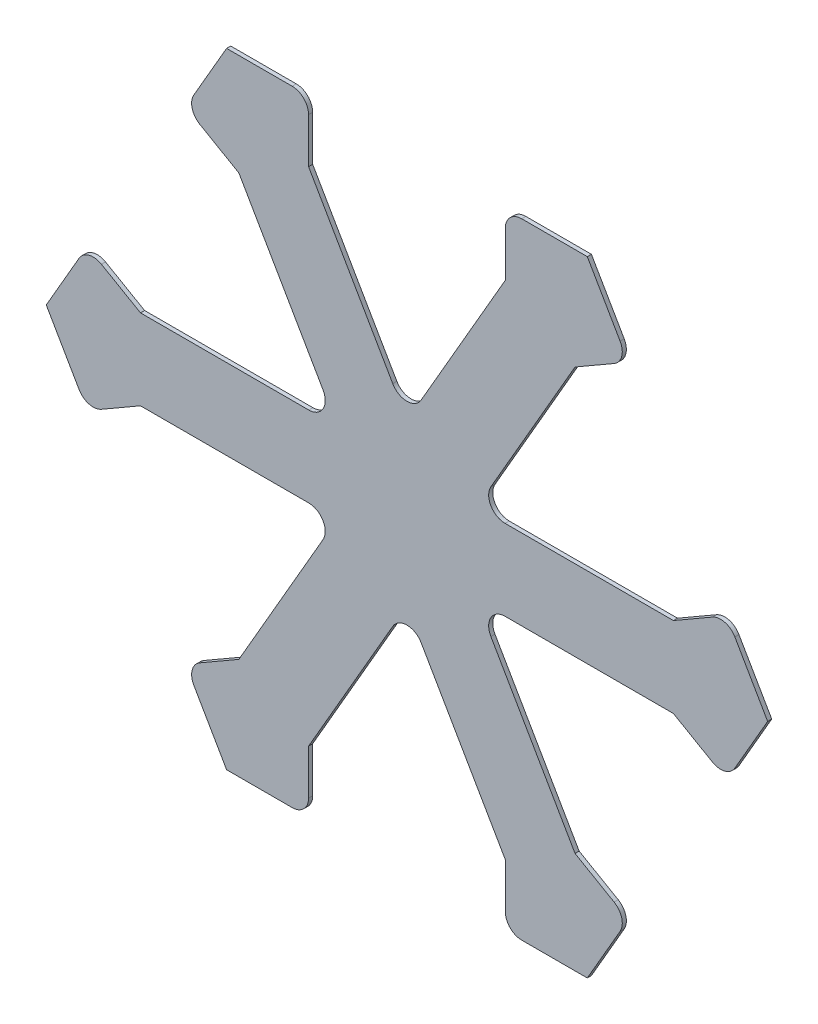
from build123d import *

# Parameters (mm, degrees)
BOSS_EXTRU_2_DEPTH = 5


with BuildPart() as part:
    # Esquisse2 → Boss.-Extru.2 (new body)
    with BuildSketch(Plane.XY):
        with BuildLine():
            Line((-440, 0), (-400, -69.282032303))
            ThreePointArc((-400, -69.282032303), (-387.855872826, -78.600548829), (-372.679491924, -76.602540378))
            Line((-372.679491924, -76.602540378), (-325.048094716, -49.102540378))
            Line((-325.048094716, -49.102540378), (-119.689110868, -49.102540378))
            ThreePointArc((-119.689110868, -49.102540378), (-102.368602792, -59.102540378), (-102.368602792, -79.102540378))
            Line((-102.368602792, -79.102540378), (-205.048094716, -256.948637287))
            Line((-205.048094716, -256.948637287), (-252.679491924, -284.448637287))
            ThreePointArc((-252.679491924, -284.448637287), (-261.99800845, -296.59276446), (-260, -311.769145362))
            Line((-260, -311.769145362), (-220, -381.051177665))
            Line((-220, -381.051177665), (-140, -381.051177665))
            ThreePointArc((-140, -381.051177665), (-125.857864376, -375.193313289), (-120, -361.051177665))
            Line((-120, -361.051177665), (-120, -306.051177665))
            Line((-120, -306.051177665), (-17.320508076, -128.205080757))
            ThreePointArc((-17.320508076, -128.205080757), (0, -118.205080757), (17.320508076, -128.205080757))
            Line((17.320508076, -128.205080757), (120, -306.051177665))
            Line((120, -306.051177665), (120, -361.051177665))
            ThreePointArc((120, -361.051177665), (125.857864376, -375.193313289), (140, -381.051177665))
            Line((140, -381.051177665), (220, -381.051177665))
            Line((220, -381.051177665), (260, -311.769145362))
            ThreePointArc((260, -311.769145362), (261.99800845, -296.59276446), (252.679491924, -284.448637287))
            Line((252.679491924, -284.448637287), (205.048094716, -256.948637287))
            Line((205.048094716, -256.948637287), (102.368602792, -79.102540378))
            ThreePointArc((102.368602792, -79.102540378), (102.368602792, -59.102540378), (119.689110868, -49.102540378))
            Line((119.689110868, -49.102540378), (325.048094716, -49.102540378))
            Line((325.048094716, -49.102540378), (372.679491924, -76.602540378))
            ThreePointArc((372.679491924, -76.602540378), (387.855872826, -78.600548829), (400, -69.282032303))
            Line((400, -69.282032303), (440, 0))
            Line((440, 0), (400, 69.282032303))
            ThreePointArc((400, 69.282032303), (387.855872826, 78.600548829), (372.679491924, 76.602540378))
            Line((372.679491924, 76.602540378), (325.048094716, 49.102540378))
            Line((325.048094716, 49.102540378), (119.689110868, 49.102540378))
            ThreePointArc((119.689110868, 49.102540378), (102.368602792, 59.102540378), (102.368602792, 79.102540378))
            Line((102.368602792, 79.102540378), (205.048094716, 256.948637287))
            Line((205.048094716, 256.948637287), (252.679491924, 284.448637287))
            ThreePointArc((252.679491924, 284.448637287), (261.99800845, 296.59276446), (260, 311.769145362))
            Line((260, 311.769145362), (220, 381.051177665))
            Line((220, 381.051177665), (140, 381.051177665))
            ThreePointArc((140, 381.051177665), (125.857864376, 375.193313289), (120, 361.051177665))
            Line((120, 361.051177665), (120, 306.051177665))
            Line((120, 306.051177665), (17.320508076, 128.205080757))
            ThreePointArc((17.320508076, 128.205080757), (0, 118.205080757), (-17.320508076, 128.205080757))
            Line((-17.320508076, 128.205080757), (-120, 306.051177665))
            Line((-120, 306.051177665), (-120, 361.051177665))
            ThreePointArc((-120, 361.051177665), (-125.857864376, 375.193313289), (-140, 381.051177665))
            Line((-140, 381.051177665), (-220, 381.051177665))
            Line((-220, 381.051177665), (-260, 311.769145362))
            ThreePointArc((-260, 311.769145362), (-261.99800845, 296.59276446), (-252.679491924, 284.448637287))
            Line((-252.679491924, 284.448637287), (-205.048094716, 256.948637287))
            Line((-205.048094716, 256.948637287), (-102.368602792, 79.102540378))
            ThreePointArc((-102.368602792, 79.102540378), (-102.368602792, 59.102540378), (-119.689110868, 49.102540378))
            Line((-119.689110868, 49.102540378), (-325.048094716, 49.102540378))
            Line((-325.048094716, 49.102540378), (-372.679491924, 76.602540378))
            ThreePointArc((-372.679491924, 76.602540378), (-387.855872826, 78.600548829), (-400, 69.282032303))
            Line((-400, 69.282032303), (-440, 0))
        make_face()
    extrude(amount=BOSS_EXTRU_2_DEPTH)


solid = part.part
